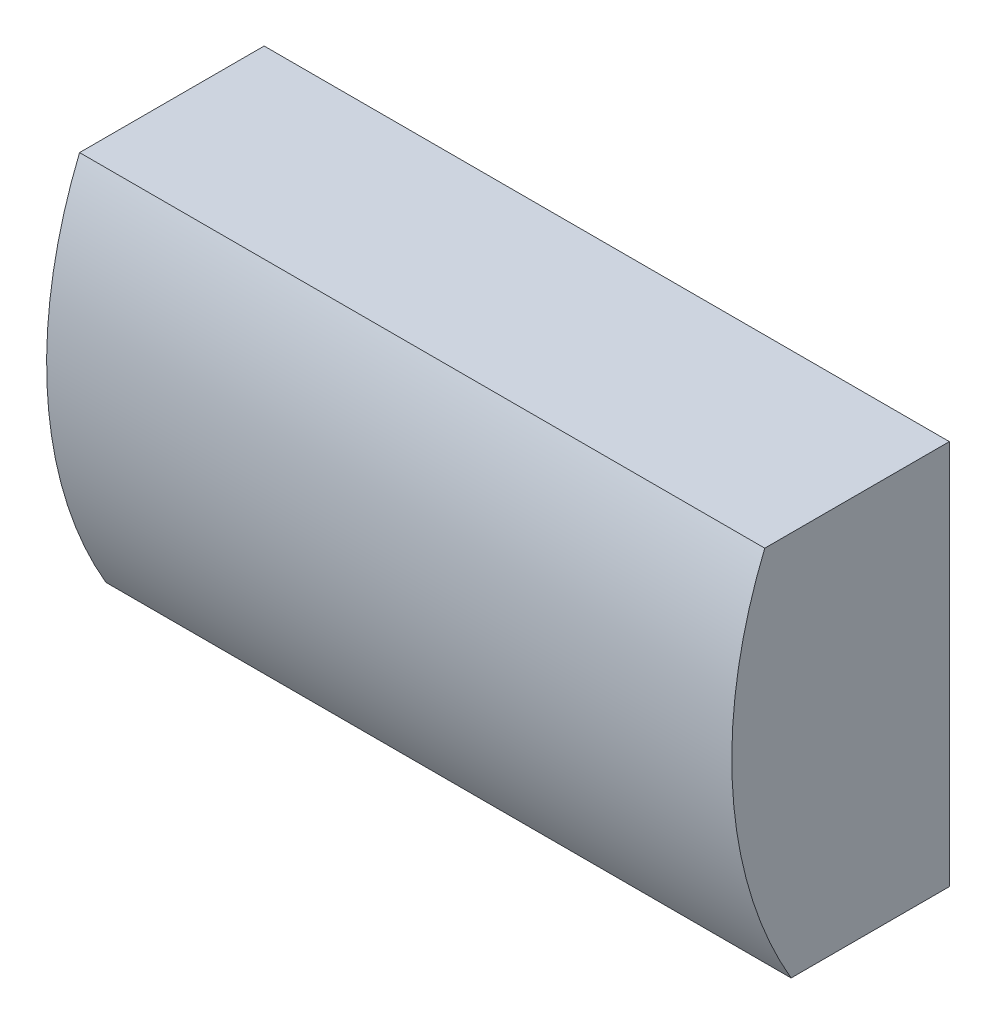
from build123d import *

# Parameters (mm, degrees)
SKETCH1_W           = 80
SKETCH1_H           = 45
BOSS_EXTRUDE1_DEPTH = 25.4
CUT_EXTRUDE5_DEPTH  = 101.6


with BuildPart() as part:
    # Sketch1 → Boss-Extrude1 (new body)
    with BuildSketch(Plane.XY):
        with Locations((-4.545454545, -3.106060606)):
            Rectangle(SKETCH1_W, SKETCH1_H)
    extrude(amount=BOSS_EXTRUDE1_DEPTH)

    # Sketch2 → Cut-Extrude5 (cut)
    with BuildSketch(Plane.ZY.offset(44.545454545)):
        with BuildLine():
            ThreePointArc((21.552264214, 19.393939394), (24.428781954, 9.885974356), (25.4, 0))
            Line((25.4, 0), (25.4, 19.393939394))
            Line((25.4, 19.393939394), (21.552264214, 19.393939394))
        make_face()
        with BuildLine():
            Line((25.4, -25.606060606), (25.4, 0))
            ThreePointArc((25.4, 0), (23.638063736, -13.263042825), (18.474476182, -25.606060606))
            Line((18.474476182, -25.606060606), (25.4, -25.606060606))
        make_face()
    extrude(amount=-CUT_EXTRUDE5_DEPTH, mode=Mode.SUBTRACT)


solid = part.part
